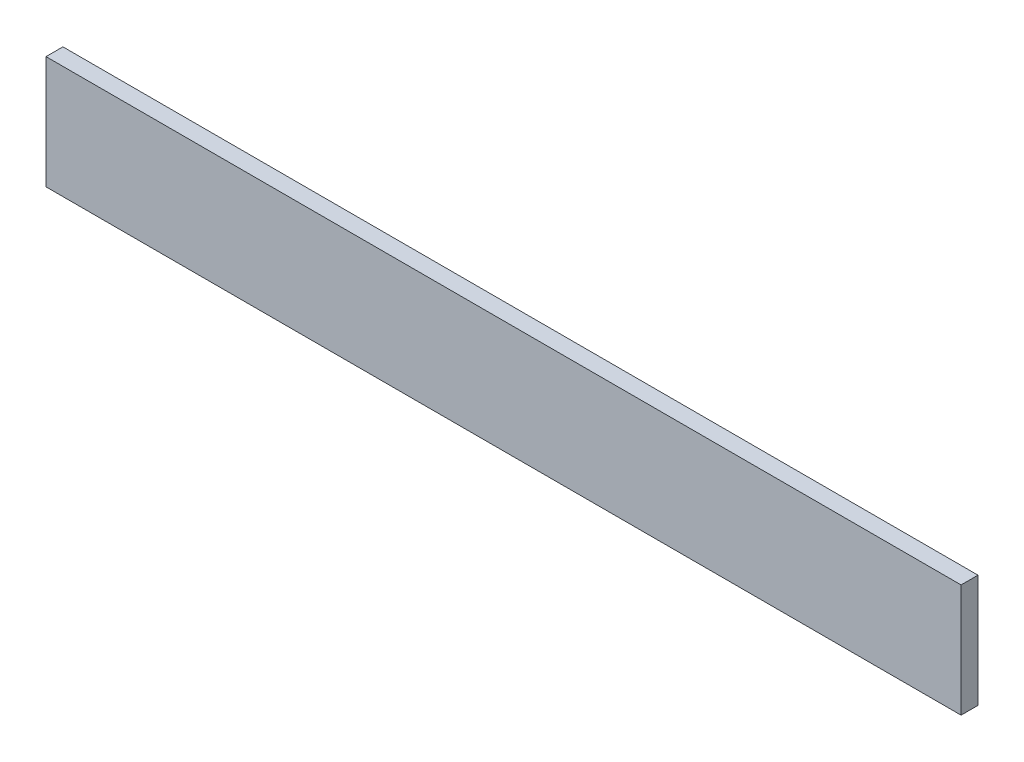
from build123d import *

# Parameters (mm, degrees)
CROQUIS1_W              = 811.2
CROQUIS1_H              = 100
SALIENTE_EXTRUIR1_DEPTH = 15


with BuildPart() as part:
    # Croquis1 → Saliente-Extruir1 (new body)
    with BuildSketch(Plane.XY):
        Rectangle(CROQUIS1_W, CROQUIS1_H)
    extrude(amount=SALIENTE_EXTRUIR1_DEPTH)


solid = part.part
